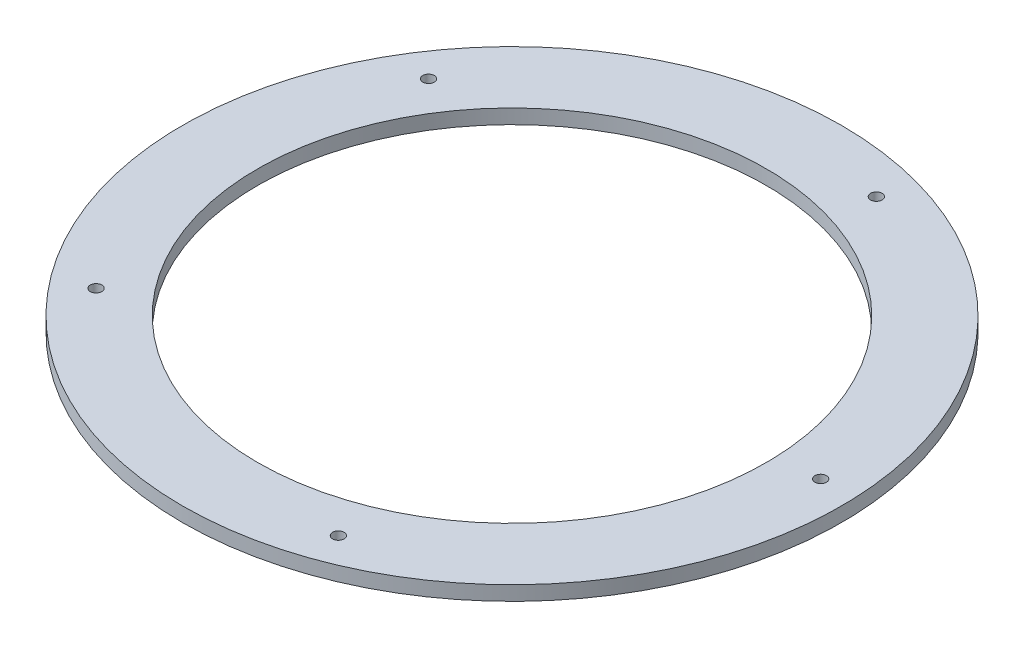
from build123d import *

# Parameters (mm, degrees)
SKETCH1_R           = 72.39
SKETCH1_R_2         = 55.88
BOSS_EXTRUDE1_DEPTH = 3.175
SKETCH2_R           = 1.27
CUT_EXTRUDE1_DEPTH  = 103.424141807
CIRPATTERN1_COUNT   = 5


with BuildPart() as part:
    # Sketch1 → Boss-Extrude1 (new body)
    with BuildSketch(Plane(origin=(0, 0, 0), x_dir=(1, 0, 0), z_dir=(0, 1, 0))):
        with Locations(Location((0, 0, 0), (0, 0, 270))):
            Circle(SKETCH1_R)
        with Locations(Location((0, 0, 0), (0, 0, 270))):
            Circle(SKETCH1_R_2, mode=Mode.SUBTRACT)
    extrude(amount=BOSS_EXTRUDE1_DEPTH)

    # Sketch2 → Cut-Extrude1 (cut, through all)
    with BuildSketch(Plane(origin=(0, 3.175, 0), x_dir=(1, 0, 0), z_dir=(0, 1, 0))):
        with Locations(Location((17.376908166, 62.659106589, 0), (0, 0, 270))):
            Circle(SKETCH2_R)
    cut_extrude1 = extrude(amount=-CUT_EXTRUDE1_DEPTH, mode=Mode.SUBTRACT)

    # CirPattern1: Cut-Extrude1 ×5 about axis
    cirpattern1_axis = Axis((0, 0, 0), (0, 1, 0))
    for i in range(1, CIRPATTERN1_COUNT):
        add(cut_extrude1.rotate(cirpattern1_axis, i * 360 / CIRPATTERN1_COUNT), mode=Mode.SUBTRACT)


solid = part.part
